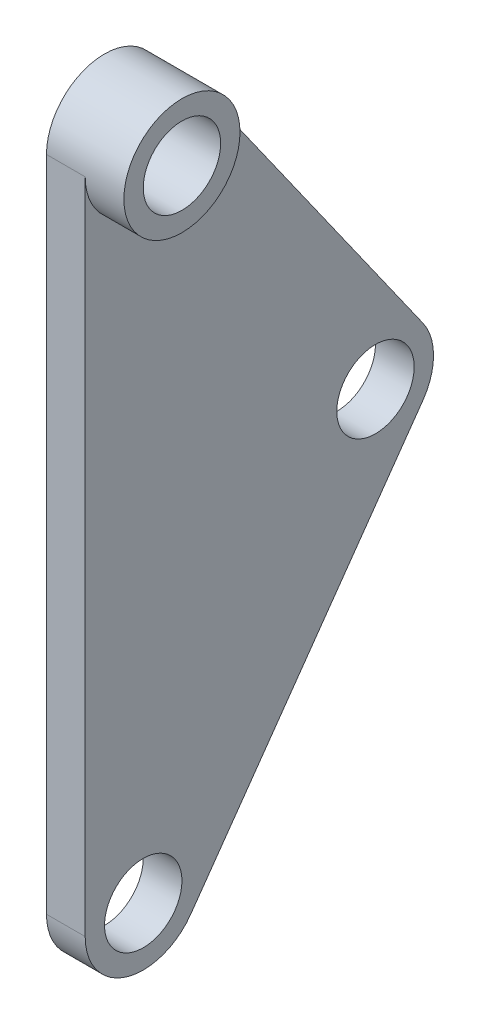
from build123d import *

# Parameters (mm, degrees)
EXTRUDE_1_DEPTH          = 2
EXTRUDE_START            = 2
SKETCH_1_4_R             = 3
EXTRUDE_2_DEPTH          = 2
CUT_EXTRUDE_1_DEPTH      = 45.045431091
CUT_EXTRUDE_1_DEPTH_BACK = 45.045431091
SKETCH_1_3_R             = 2


with BuildPart() as part:
    # 草图1 → 凸台-拉伸1 (new body)
    with BuildSketch(Plane(origin=(0, 0, 0), x_dir=(0, 0, -1), z_dir=(1, 0, 0))):
        with BuildLine():
            Line((17.45090359, -18.269950407), (5.45090359, -1.269950407))
            ThreePointArc((5.45090359, -1.269950407), (2.092451315, -0.140567297), (0, -3))
            Line((0, -3), (0, -37))
            ThreePointArc((0, -37), (2.092451315, -39.859432703), (5.45090359, -38.730049593))
            Line((5.45090359, -38.730049593), (17.45090359, -21.730049593))
            ThreePointArc((17.45090359, -21.730049593), (18, -20), (17.45090359, -18.269950407))
        make_face()
    extrude(amount=EXTRUDE_1_DEPTH)

    # 草图1<4> → 凸台-拉伸2 (add)
    with BuildSketch(Plane(origin=(0, 0, 0), x_dir=(0, 0, -1), z_dir=(1, 0, 0)).offset(EXTRUDE_START)):
        with Locations(Location((3, -3, 0), (0, 0, 180))):
            Circle(SKETCH_1_4_R)
    extrude(amount=EXTRUDE_2_DEPTH)

    # 草图1<3> → 切除-拉伸1 (cut, two sides: drawn at the far end of the back side and taken through both)
    with BuildSketch(Plane(origin=(0, 0, 0), x_dir=(0, 0, -1), z_dir=(1, 0, 0)).offset(-CUT_EXTRUDE_1_DEPTH_BACK)):
        with Locations((3, -3)):
            Circle(SKETCH_1_3_R)
        with Locations((15, -20)):
            Circle(SKETCH_1_3_R)
        with Locations((3, -37)):
            Circle(SKETCH_1_3_R)
    extrude(amount=CUT_EXTRUDE_1_DEPTH + CUT_EXTRUDE_1_DEPTH_BACK, mode=Mode.SUBTRACT)


solid = part.part
